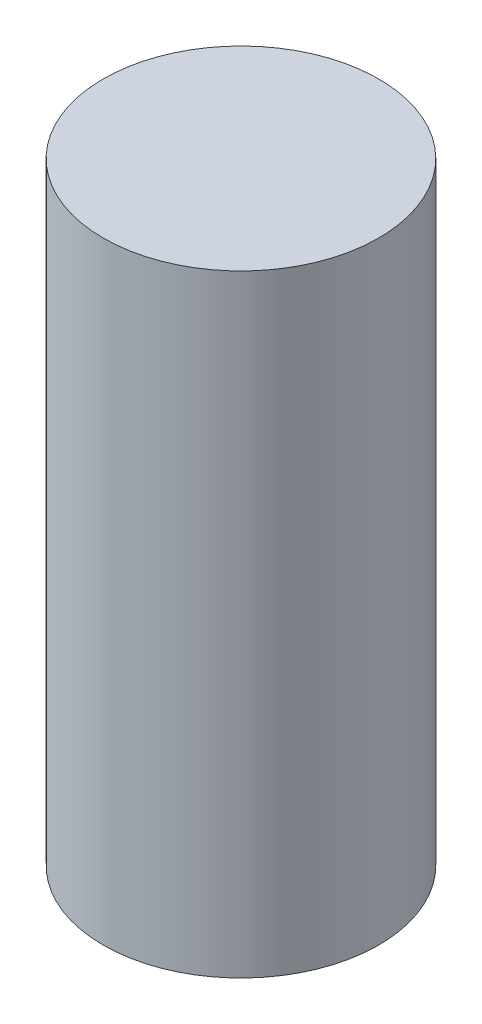
from build123d import *

# Parameters (mm, degrees)
SKETCH2_R           = 4.5
BOSS_EXTRUDE1_DEPTH = 20


with BuildPart() as part:
    # Sketch2 → Boss-Extrude1 (new body)
    with BuildSketch(Plane(origin=(0, 0, 0), x_dir=(1, 0, 0), z_dir=(0, 1, 0))):
        with Locations(Location((-2.719195466, 2.471995878, 0), (0, 0, 270))):
            Circle(SKETCH2_R)
    extrude(amount=BOSS_EXTRUDE1_DEPTH)


solid = part.part
